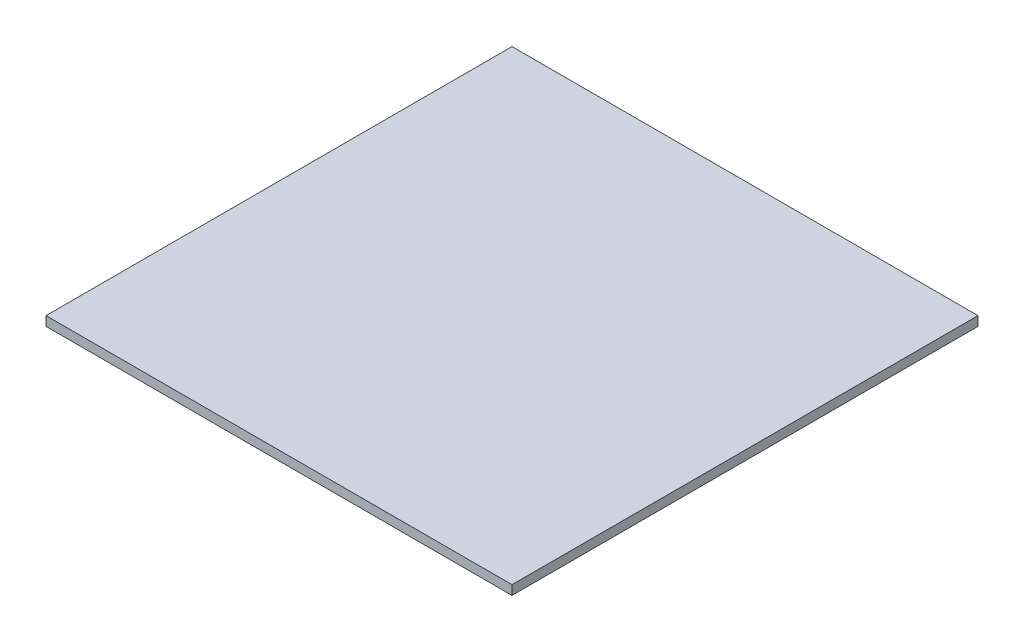
from build123d import *

# Parameters (mm, degrees)
ESQUISSE1_W        = 500
ESQUISSE1_H        = 500
BOSS_EXTRU_1_DEPTH = 10


with BuildPart() as part:
    # Esquisse1 → Boss.-Extru.1 (new body)
    with BuildSketch(Plane(origin=(0, 0, 0), x_dir=(1, 0, 0), z_dir=(0, 1, 0))):
        with Locations((161.642938144, 186.634010599)):
            Rectangle(ESQUISSE1_W, ESQUISSE1_H)
    extrude(amount=BOSS_EXTRU_1_DEPTH)


solid = part.part
